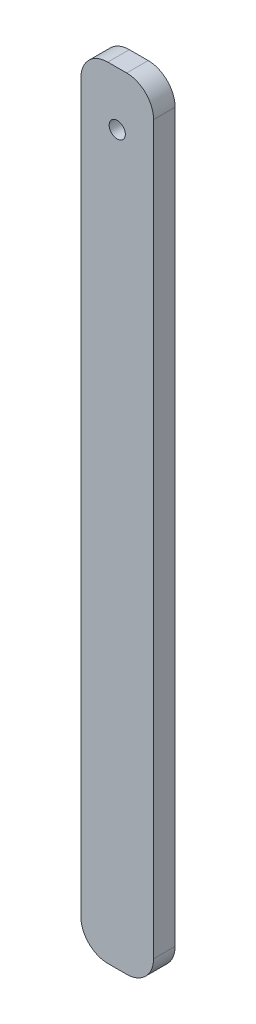
from build123d import *

# Parameters (mm, degrees)
SKETCH1_R           = 3
BOSS_EXTRUDE1_DEPTH = 8


with BuildPart() as part:
    # Sketch1 → Boss-Extrude1 (new body)
    with BuildSketch(Plane.XY):
        with BuildLine():
            ThreePointArc((3.5, 145), (10.571067812, 142.071067812), (13.5, 135))
            Line((13.5, 135), (13.5, -135))
            ThreePointArc((13.5, -135), (10.571067812, -142.071067812), (3.5, -145))
            Line((3.5, -145), (-3.5, -145))
            ThreePointArc((-3.5, -145), (-10.571067812, -142.071067812), (-13.5, -135))
            Line((-13.5, -135), (-13.5, 135))
            ThreePointArc((-13.5, 135), (-10.571067812, 142.071067812), (-3.5, 145))
            Line((-3.5, 145), (3.5, 145))
        make_face()
        with Locations((0, 125)):
            Circle(SKETCH1_R, mode=Mode.SUBTRACT)
    extrude(amount=BOSS_EXTRUDE1_DEPTH)


solid = part.part
